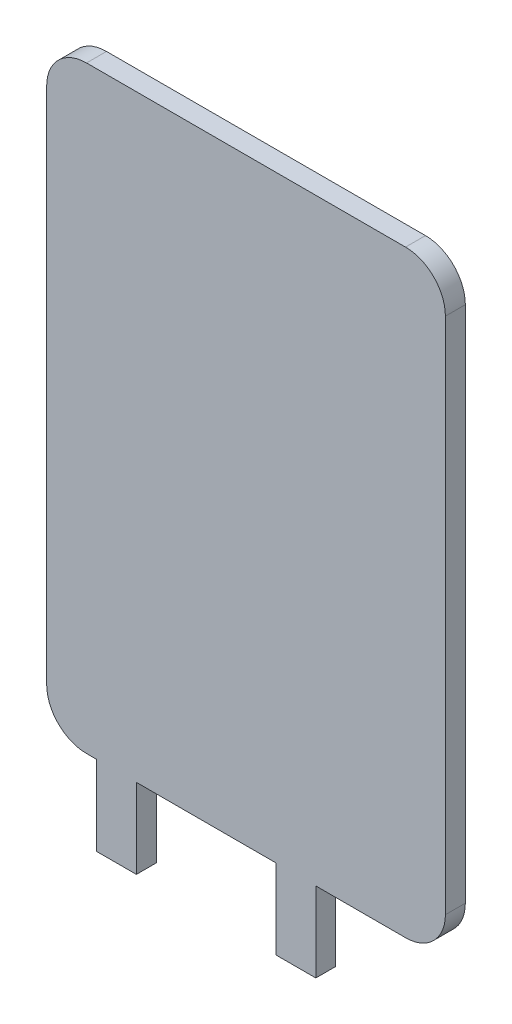
from build123d import *

# Parameters (mm, degrees)
SKETCH_1_W      = 40
SKETCH_1_H      = 60
SKETCH_1_W_2    = 4
SKETCH_1_H_2    = 8
EXTRUDE_1_DEPTH = 2
FILLET_1_R      = 4


with BuildPart() as part:
    # 草图1 → 凸台-拉伸1 (new body)
    with BuildSketch(Plane.XY):
        Rectangle(SKETCH_1_W, SKETCH_1_H)
        with Locations((-13, -34)):
            Rectangle(SKETCH_1_W_2, SKETCH_1_H_2)
        with Locations((5, -34)):
            Rectangle(SKETCH_1_W_2, SKETCH_1_H_2)
    extrude(amount=EXTRUDE_1_DEPTH)

    # 圆角1
    fillet_1_edges = [part.edges().sort_by_distance(p)[0] for p in [
        (20, -30, 1),
        (-20, -30, 1),
        (-20, 30, 1),
        (20, 30, 1),
    ]]
    fillet(fillet_1_edges, radius=FILLET_1_R)


solid = part.part
